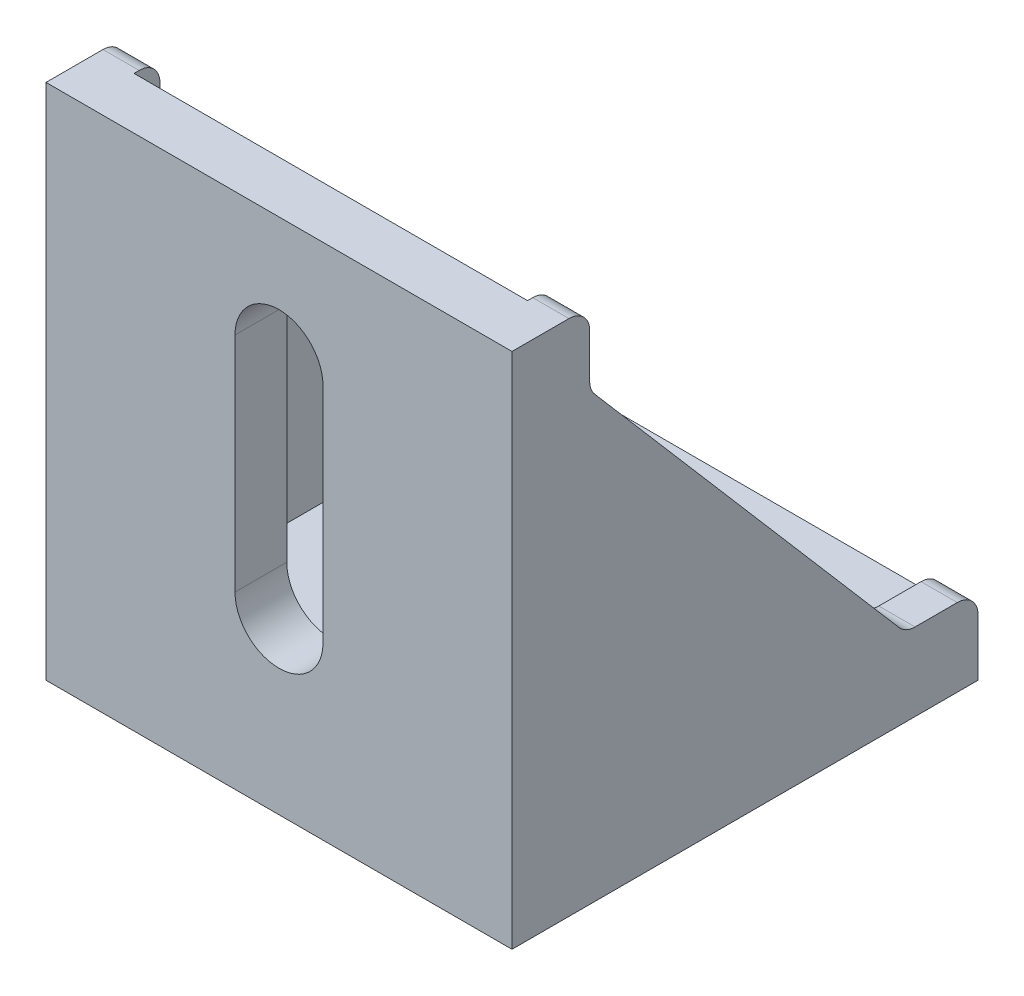
from build123d import *

# Parameters (mm, degrees)
EXTRUDE_1_DEPTH     = 45
EXTRUDE_2_DEPTH     = 3.5
CUT_EXTRUDE_1_REACH = 77.166
CUT_EXTRUDE_2_REACH = 79.942
FILLET_1_R          = 2


with BuildPart() as part:
    # 草图1 → 凸台-拉伸1 (new body)
    with BuildSketch(Plane(origin=(0, 0, 0), x_dir=(0, 0, -1), z_dir=(1, 0, 0))):
        Polygon((0, 0), (0, 45), (5, 45), (5, 0), (45, 0), (45, -5), (0, -5), align=None)
    extrude(amount=EXTRUDE_1_DEPTH)

    # 草图2 → 凸台-拉伸2 (add)
    with BuildSketch(Plane(origin=(45, 0, 0), x_dir=(0, 0, -1), z_dir=(1, 0, 0))):
        Polygon((45, 0), (45, 2.5), (38, 2.5), (7.5, 38), (7.5, 45), (5, 45), (5, 0), align=None)
    extrude_2 = extrude(amount=-EXTRUDE_2_DEPTH)

    # 镜向1: 凸台-拉伸2 across plane
    add(extrude_2.mirror(Plane(origin=(22.5, 0, 0), x_dir=(0, 0, 1), z_dir=(1, 0, 0))))

    # 草图4 → 切除-拉伸1 (cut, up to next)
    with BuildSketch(Plane(origin=(0, 0, -5), x_dir=(-1, 0, 0), z_dir=(0, 0, -1)), mode=Mode.PRIVATE) as cut_extrude_1_sk1:
        with BuildLine():
            Line((-18.25, 33), (-18.25, 11.5))
            ThreePointArc((-18.25, 11.5), (-22.5, 7.25), (-26.75, 11.5))
            Line((-26.75, 11.5), (-26.75, 33))
            ThreePointArc((-26.75, 33), (-22.5, 37.25), (-18.25, 33))
        make_face()
    cut_extrude_1_tool1 = extrude(cut_extrude_1_sk1.sketch, amount=-CUT_EXTRUDE_1_REACH, mode=Mode.PRIVATE) & part.part
    add(cut_extrude_1_tool1.solids().sort_by_distance((22.5, 22.25, -5))[0], mode=Mode.SUBTRACT)

    # 草图5 → 切除-拉伸2 (cut, up to next)
    with BuildSketch(Plane(origin=(0, 0, 0), x_dir=(1, 0, 0), z_dir=(0, 1, 0)), mode=Mode.PRIVATE) as cut_extrude_2_sk1:
        with BuildLine():
            Line((26.75, 37), (26.75, 15.5))
            ThreePointArc((26.75, 15.5), (22.5, 11.25), (18.25, 15.5))
            Line((18.25, 15.5), (18.25, 37))
            ThreePointArc((18.25, 37), (22.5, 41.25), (26.75, 37))
        make_face()
    cut_extrude_2_tool1 = extrude(cut_extrude_2_sk1.sketch, amount=-CUT_EXTRUDE_2_REACH, mode=Mode.PRIVATE) & part.part
    add(cut_extrude_2_tool1.solids().sort_by_distance((22.5, 0, -26.25))[0], mode=Mode.SUBTRACT)

    # 圆角1
    fillet_1_edges = [part.edges().sort_by_distance(p)[0] for p in [
        (43.25, 45, -7.5),
        (43.25, 38, -7.5),
        (43.25, 2.5, -38),
        (43.25, 2.5, -45),
        (1.75, 2.5, -45),
        (1.75, 2.5, -38),
        (1.75, 38, -7.5),
        (1.75, 45, -7.5),
    ]]
    fillet(fillet_1_edges, radius=FILLET_1_R)


solid = part.part
